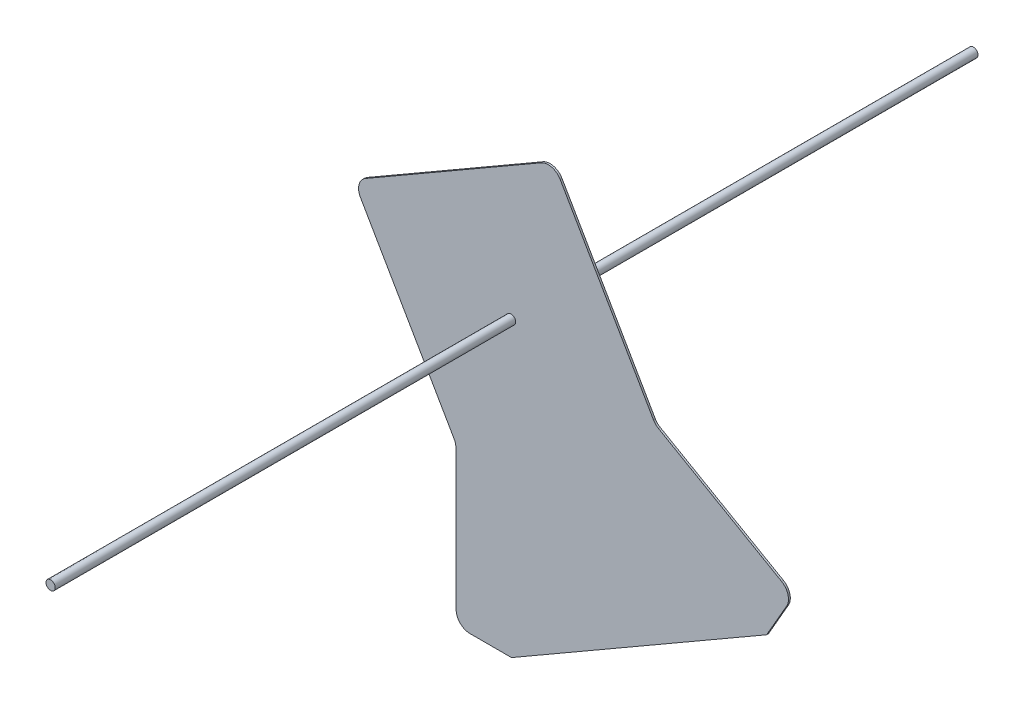
from build123d import *

# Parameters (mm, degrees)
BOSS_EXTRUDE1_DEPTH = 2
SKETCH1_4_R         = 10
BOSS_EXTRUDE2_DEPTH = 1000
FILLET1_R           = 30


with BuildPart() as part:
    # Sketch1 → Boss-Extrude1 (new, symmetric)
    with BuildSketch(Plane.XY):
        Polygon((51.098896592, 549.111782584), (109.556303029, 650.722199952), (-190.085319823, 823.108777884), (-411.145086474, 1205.995525233), (-844.157788367, 955.995525233), (-622.202758989, 571.558137356), (-621.679381509, 229.965176242), (-501.679240657, 229.965176242), align=None)
    extrude(amount=BOSS_EXTRUDE1_DEPTH, both=True)

    # Sketch1<4> → Boss-Extrude2 (add, symmetric)
    with BuildSketch(Plane.XY):
        with Locations((-502.65143742, 864.489174287)):
            Circle(SKETCH1_4_R)
    extrude(amount=BOSS_EXTRUDE2_DEPTH, both=True)

    # Fillet1
    fillet1_edges = [part.edges().sort_by_distance(p)[0] for p in [
        (-190.085319823, 823.108777884, 0),
        (-622.202758989, 571.558137356, 0),
        (-621.679381509, 229.965176242, 0),
        (109.556303029, 650.722199952, 0),
        (-411.145086474, 1205.995525233, 0),
        (-844.157788367, 955.995525233, 0),
    ]]
    fillet(fillet1_edges, radius=FILLET1_R)


solid = part.part
